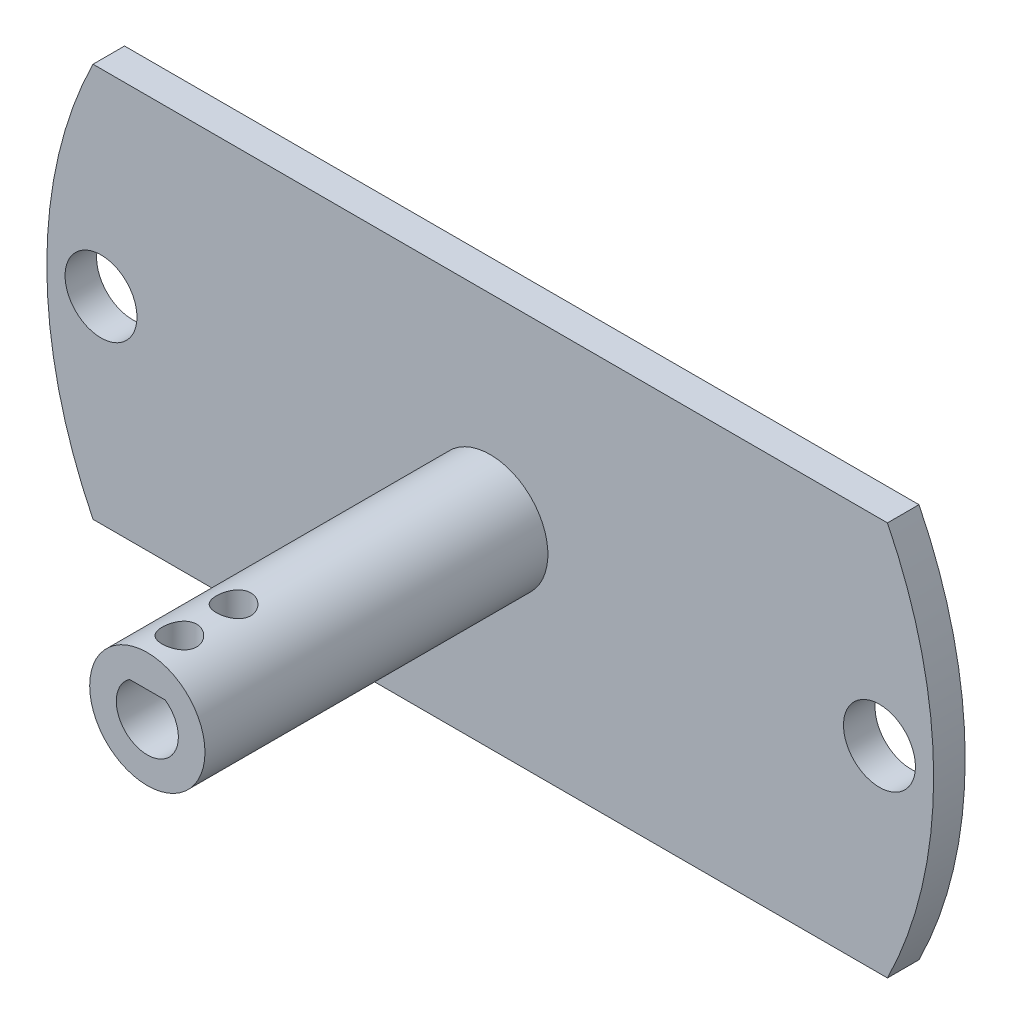
from build123d import *

# Parameters (mm, degrees)
CROQUIS1_R                 = 5.85
SALIENTE_EXTRUIR1_DEPTH    = 38
CROQUIS2_R                 = 1.75
CORTAR_EXTRUIR1_DEPTH      = 7.5
CROQUIS3_R                 = 45
SALIENTE_EXTRUIR2_DEPTH    = 3.2
CORTAR_EXTRUIR2_DEPTH      = 75.121521892
CORTAR_EXTRUIR2_DEPTH_BACK = 5
CROQUIS5_R                 = 3.65


with BuildPart() as part:
    # Croquis1 → Saliente-Extruir1 (new body)
    with BuildSketch(Plane.XY):
        Circle(CROQUIS1_R)
        with BuildLine():
            Line((-1.8, 2.585053191), (1.8, 2.585053191))
            ThreePointArc((1.8, 2.585053191), (0, -3.15), (-1.8, 2.585053191))
        make_face(mode=Mode.SUBTRACT)
    extrude(amount=SALIENTE_EXTRUIR1_DEPTH)

    # Croquis2 → Cortar-Extruir1 (cut)
    with BuildSketch(Plane(origin=(0, 2.585053191, 0), x_dir=(1, 0, 0), z_dir=(0, 1, 0))):
        with Locations((0, -34.75)):
            Circle(CROQUIS2_R)
        with Locations((0, -29.25)):
            Circle(CROQUIS2_R)
    extrude(amount=CORTAR_EXTRUIR1_DEPTH, mode=Mode.SUBTRACT)

    # Croquis3 → Saliente-Extruir2 (add)
    with BuildSketch(Plane(origin=(0, 0, 0), x_dir=(-1, 0, 0), z_dir=(0, 0, -1))):
        Circle(CROQUIS3_R)
    extrude(amount=-SALIENTE_EXTRUIR2_DEPTH)

    # Croquis5 → Cortar-Extruir2 (cut, two sides: drawn at the far end of the back side and taken through both)
    with BuildSketch(Plane(origin=(0, 0, 0), x_dir=(-1, 0, 0), z_dir=(0, 0, -1)).offset(-CORTAR_EXTRUIR2_DEPTH_BACK)):
        with Locations(Location((-39.5, 0, 0), (0, 0, 180))):
            Circle(CROQUIS5_R)
        with Locations(Location((39.5, 0, 0), (0, 0, 180))):
            Circle(CROQUIS5_R)
        Polygon((0, 20), (-75, 20), (-75, 50), (75, 50), (75, 20), align=None)
        Polygon((75, -50), (75, -20), (0, -20), (-75, -20), (-75, -50), align=None)
    extrude(amount=CORTAR_EXTRUIR2_DEPTH + CORTAR_EXTRUIR2_DEPTH_BACK, mode=Mode.SUBTRACT)


solid = part.part
